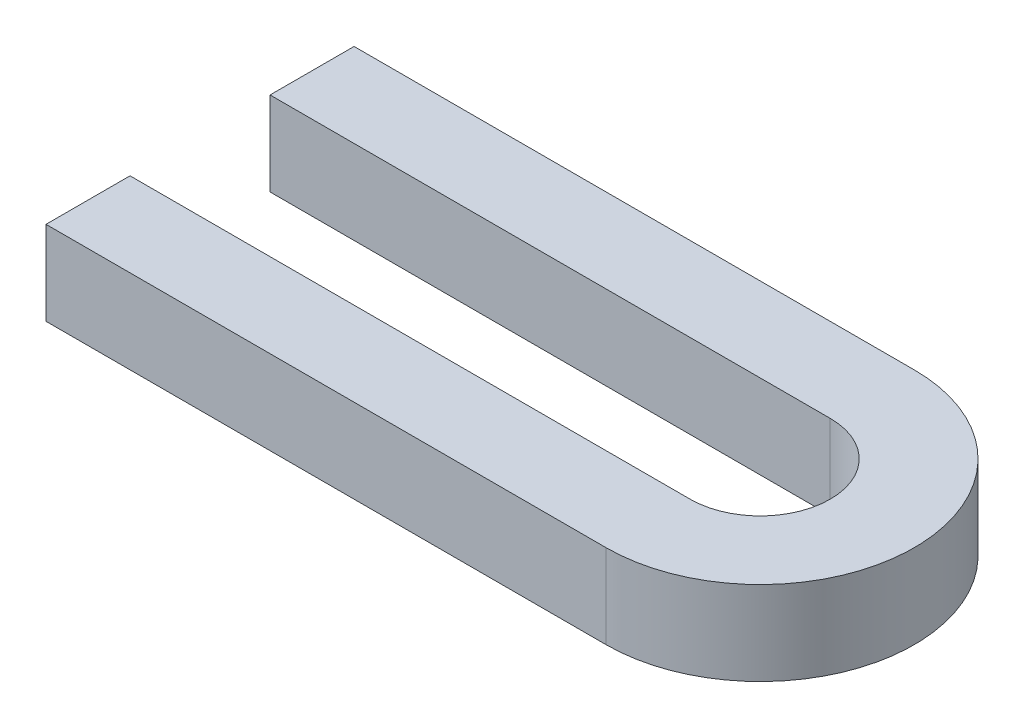
from build123d import *

# Parameters (mm, degrees)
EXTRUDE_1_DEPTH = 3


with BuildPart() as part:
    # 草图1 → 凸台-拉伸1 (new body)
    with BuildSketch(Plane(origin=(0, 0, 0), x_dir=(1, 0, 0), z_dir=(0, 1, 0))):
        with BuildLine():
            Line((0, 2.5), (-20, 2.5))
            Line((-20, 2.5), (-20, 5.5))
            Line((-20, 5.5), (0, 5.5))
            ThreePointArc((0, 5.5), (5.5, 0), (0, -5.5))
            Line((0, -5.5), (-20, -5.5))
            Line((-20, -5.5), (-20, -2.5))
            Line((-20, -2.5), (0, -2.5))
            ThreePointArc((0, -2.5), (2.5, 0), (0, 2.5))
        make_face()
    extrude(amount=EXTRUDE_1_DEPTH)


solid = part.part
